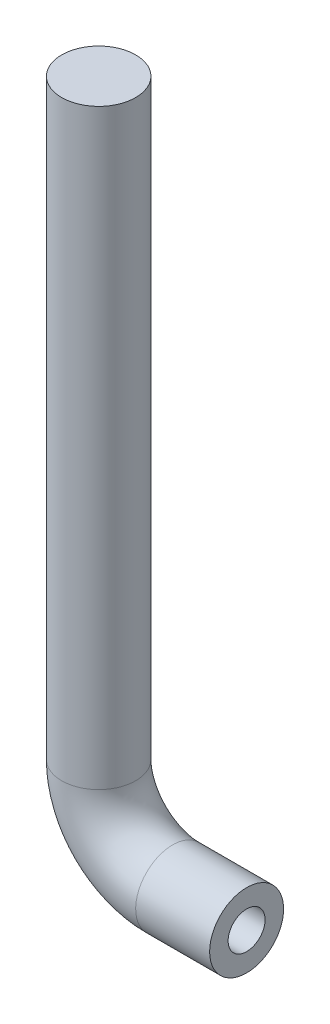
from build123d import *

# Parameters (mm, degrees)
SKETCH1_R          = 6.35
SKETCH3_R          = 3.175
CUT_EXTRUDE1_DEPTH = 6.35


with BuildPart() as part:
    # Sweep1: sweep along a path in Sketch2
    with BuildLine(Plane.XY) as sweep1_path:
        Line((0, 0), (0, -101.6))
        ThreePointArc((0, -101.6), (3.719743879, -110.580256121), (12.7, -114.3))
        Line((12.7, -114.3), (25.4, -114.3))
    # Sketch1 → Sweep1 (sweep)
    with BuildSketch(Plane(origin=(0, 0, 0), x_dir=(1, 0, 0), z_dir=(0, 1, 0))):
        Circle(SKETCH1_R)
    sweep(path=sweep1_path.line)

    # Sketch3 → Cut-Extrude1 (cut)
    with BuildSketch(Plane(origin=(25.4, 0, 0), x_dir=(0, 0, -1), z_dir=(1, 0, 0))):
        with Locations(Location((0, -114.3, 0), (0, 0, 90))):
            Circle(SKETCH3_R)
    extrude(amount=-CUT_EXTRUDE1_DEPTH, mode=Mode.SUBTRACT)


solid = part.part
